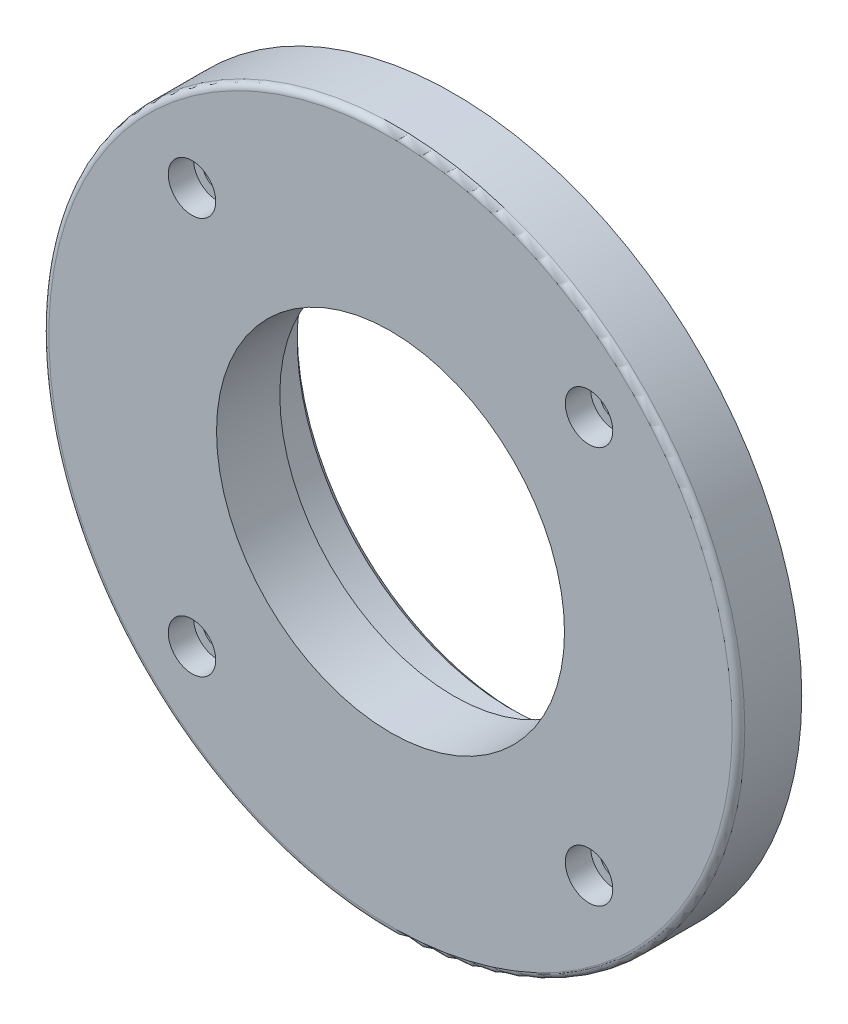
from build123d import *

# Parameters (mm, degrees)
SCHIZZO1_R                                           = 110
SCHIZZO1_R_2                                         = 55
ESTRUSIONE_ESTRUSIONE1_DEPTH                         = 20
SCHIZZO2_W                                           = 20
SCHIZZO2_H                                           = 11.25
RACCORDO1_R                                          = 2
SMUSSO1_SIZE                                         = 2
FORO_LAMATO_PER_VITE_M8_A_TESTA_CILINDRI_D           = 9
FORO_LAMATO_PER_VITE_M8_A_TESTA_CILINDRI_CBORE_D     = 15
FORO_LAMATO_PER_VITE_M8_A_TESTA_CILINDRI_CBORE_DEPTH = 8
RIPETIZIONECIRCOLARE1_COUNT                          = 4


with BuildPart() as part:
    # Schizzo1 → Estrusione-Estrusione1 (new body)
    with BuildSketch(Plane.XY):
        Circle(SCHIZZO1_R)
        Circle(SCHIZZO1_R_2, mode=Mode.SUBTRACT)
    extrude(amount=ESTRUSIONE_ESTRUSIONE1_DEPTH)

    # Schizzo2 → Rivoluzione1 (revolve)
    with BuildSketch(Plane(origin=(0, 0, 0), x_dir=(0, 0, -1), z_dir=(1, 0, 0)), mode=Mode.PRIVATE) as rivoluzione1_sk:
        with Locations((10, 73.125)):
            Rectangle(SCHIZZO2_W, SCHIZZO2_H)
    revolve(rivoluzione1_sk.sketch.rotate(Axis((0, 0, 0), (0, 0, -1)), 90), axis=Axis((0, 0, 0), (0, 0, -1)))

    # Raccordo1
    raccordo1_edges = [part.edges().sort_by_distance(p)[0] for p in [
        (-110, 0, 20),
    ]]
    fillet(raccordo1_edges, radius=RACCORDO1_R)

    # Smusso1
    smusso1_edges = [part.edges().sort_by_distance(p)[0] for p in [
        (-67.5, 0, -20),
    ]]
    chamfer(smusso1_edges, length=SMUSSO1_SIZE)

    # Foro lamato per Vite M8 a testa cilindrica piana-1 (through all)
    with Locations(Plane.XY.offset(20)):
        with Locations((-62.75572683, 62.75572683)):
            foro_lamato_per_vite_m8_a_testa_cilindri = CounterBoreHole(FORO_LAMATO_PER_VITE_M8_A_TESTA_CILINDRI_D / 2, FORO_LAMATO_PER_VITE_M8_A_TESTA_CILINDRI_CBORE_D / 2, FORO_LAMATO_PER_VITE_M8_A_TESTA_CILINDRI_CBORE_DEPTH)

    # RipetizioneCircolare1: Foro lamato per Vite M8 a testa cilindrica piana-1 ×4 about axis
    ripetizionecircolare1_axis = Axis((0, 0, 0), (0, 0, 1))
    for i in range(1, RIPETIZIONECIRCOLARE1_COUNT):
        add(foro_lamato_per_vite_m8_a_testa_cilindri.rotate(ripetizionecircolare1_axis, i * 360 / RIPETIZIONECIRCOLARE1_COUNT), mode=Mode.SUBTRACT)


solid = part.part
